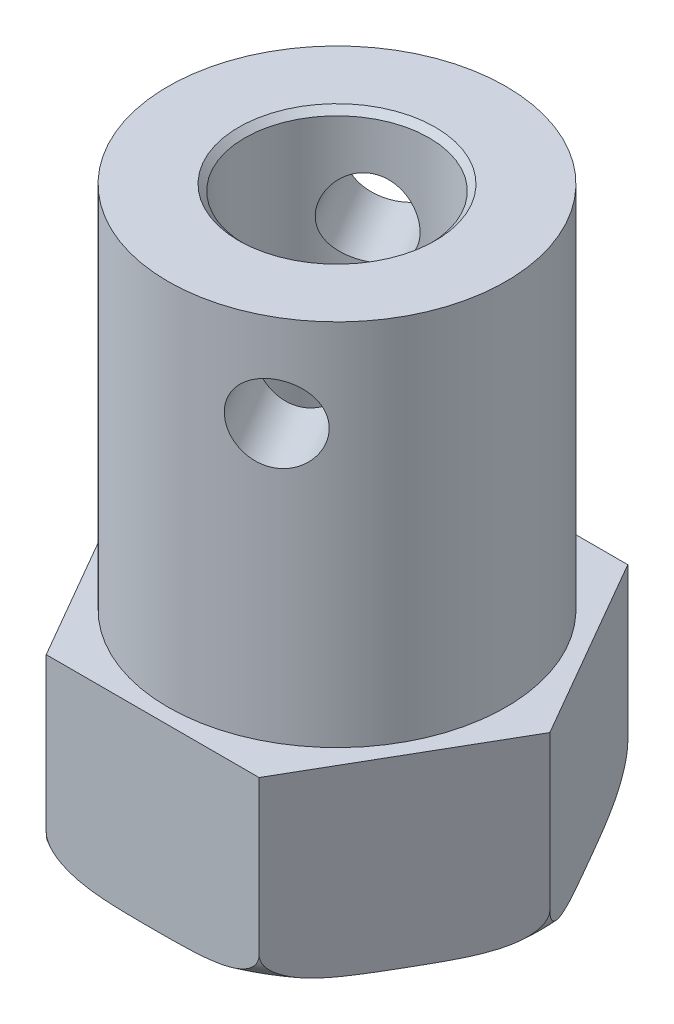
from build123d import *

# Parameters (mm, degrees)
BASE_DEPTH                      = 6
SKETCH2_R                       = 5.5
SHAFT_HOLDING_BODY_DEPTH        = 12
M4X0_7_TAPPED_HOLE1_D           = 3.3
M4X0_7_TAPPED_HOLE1_CSINK_D     = 4
M4X0_7_TAPPED_HOLE1_CSINK_ANGLE = 90
M3X0_5_TAPPED_HOLE1_D           = 2.5
SKETCH13_R                      = 3
SHAFT_HOLE_DEPTH                = 13.5
SH_C_SIZE                       = 0.2


with BuildPart() as part:
    # Sketch1 → BASE (new body)
    with BuildSketch(Plane(origin=(0, 0, 0), x_dir=(1, 0, 0), z_dir=(0, 1, 0))):
        Polygon((3.464101615, -6), (6.92820323, 0), (3.464101615, 6), (-3.464101615, 6), (-6.92820323, 0), (-3.464101615, -6), align=None)
    extrude(amount=BASE_DEPTH)

    # Sketch2 → SHAFT HOLDING BODY (add)
    with BuildSketch(Plane(origin=(0, 6, 0), x_dir=(1, 0, 0), z_dir=(0, 1, 0))):
        with Locations(Location((0, 0, 0), (0, 0, 270))):
            Circle(SKETCH2_R)
    extrude(amount=SHAFT_HOLDING_BODY_DEPTH)

    # M4x0.7 Tapped Hole1 (through all)
    with Locations(Plane(origin=(0, 0, 0), x_dir=(-1, 0, 0), z_dir=(0, -1, 0))):
        with Locations((0, 0)):
            CounterSinkHole(M4X0_7_TAPPED_HOLE1_D / 2, M4X0_7_TAPPED_HOLE1_CSINK_D / 2, counter_sink_angle=M4X0_7_TAPPED_HOLE1_CSINK_ANGLE)

    # M3x0.5 Tapped Hole1 (through all)
    with Locations(Plane(origin=(2.75, 6, 4.763139721), x_dir=(0.8660254037844385, 0, -0.5000000000000004), z_dir=(0.5000000000000003, 0, 0.8660254037844384))):
        with Locations((0, 9)):
            Hole(M3X0_5_TAPPED_HOLE1_D / 2)

    # Sketch9 → BASE CHAMFER RELIEF (revolve, cut)
    with BuildSketch(Plane.XY, mode=Mode.PRIVATE) as base_chamfer_relief_sk:
        with BuildLine():
            Line((-6.92820323, 1), (-6.92820323, 0))
            Line((-6.92820323, 0), (-5.92820323, 0))
            ThreePointArc((-5.92820323, 0), (-6.635310011, 0.292893219), (-6.92820323, 1))
        make_face()
    revolve(base_chamfer_relief_sk.sketch.rotate(Axis((0, 0, 0), (0, -1, 0)), 90), axis=Axis((0, 0, 0), (0, -1, 0)), mode=Mode.SUBTRACT)

    # Sketch13 → SHAFT HOLE (cut)
    with BuildSketch(Plane(origin=(0, 18, 0), x_dir=(1, 0, 0), z_dir=(0, 1, 0))):
        with Locations(Location((0, 0, 0), (0, 0, 270))):
            Circle(SKETCH13_R)
    extrude(amount=-SHAFT_HOLE_DEPTH, mode=Mode.SUBTRACT)

    # SH C
    sh_c_edges = [part.edges().sort_by_distance(p)[0] for p in [
        (0, 18, -3),
    ]]
    chamfer(sh_c_edges, length=SH_C_SIZE)


solid = part.part
